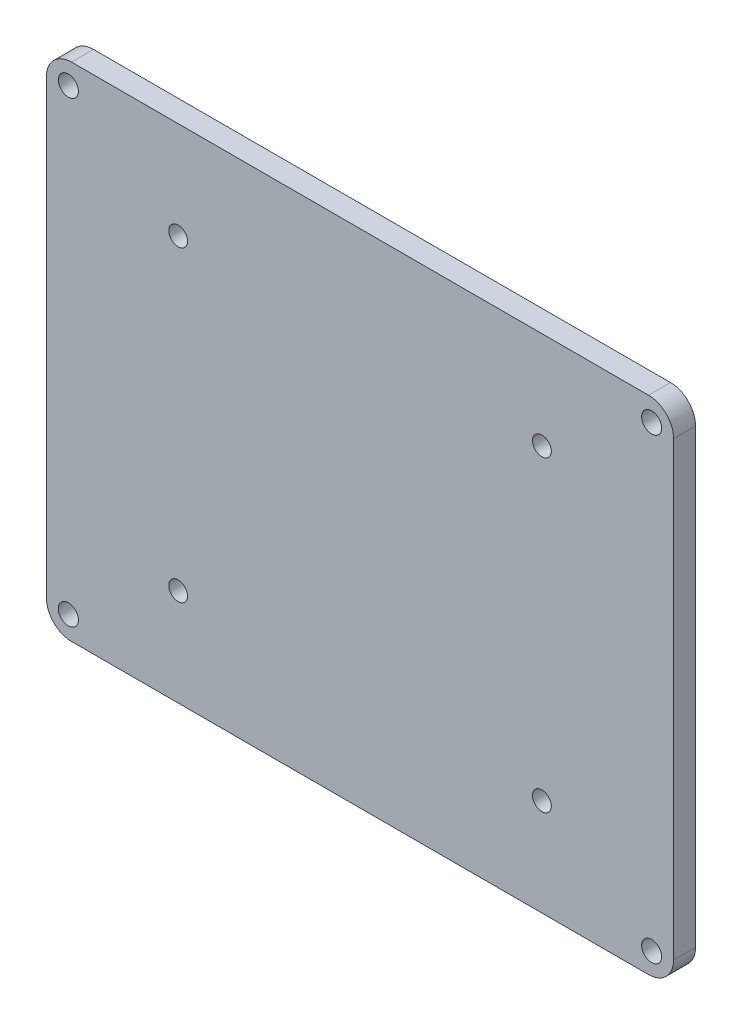
from build123d import *

# Parameters (mm, degrees)
SKETCH2_R           = 1.6
BOSS_EXTRUDE1_DEPTH = 3.5
SKETCH3_R           = 1.5
CUT_EXTRUDE1_DEPTH  = 8


with BuildPart() as part:
    # Sketch2 → Boss-Extrude1 (new body)
    with BuildSketch(Plane.XY):
        with BuildLine():
            Line((-46, -40), (46, -40))
            ThreePointArc((46, -40), (48.828427125, -38.828427125), (50, -36))
            Line((50, -36), (50, 36))
            ThreePointArc((50, 36), (48.828427125, 38.828427125), (46, 40))
            Line((46, 40), (-46, 40))
            ThreePointArc((-46, 40), (-48.828427125, 38.828427125), (-50, 36))
            Line((-50, 36), (-50, -36))
            ThreePointArc((-50, -36), (-48.828427125, -38.828427125), (-46, -40))
        make_face()
        with Locations((-46.5, 36.5)):
            Circle(SKETCH2_R, mode=Mode.SUBTRACT)
        with Locations((46.5, 36.5)):
            Circle(SKETCH2_R, mode=Mode.SUBTRACT)
        with Locations((-46.5, -36.5)):
            Circle(SKETCH2_R, mode=Mode.SUBTRACT)
        with Locations((46.5, -36.5)):
            Circle(SKETCH2_R, mode=Mode.SUBTRACT)
    extrude(amount=BOSS_EXTRUDE1_DEPTH)

    # Sketch3 → Cut-Extrude1 (cut)
    with BuildSketch(Plane.XY.offset(3.5)):
        with Locations((-29, 24.5)):
            Circle(SKETCH3_R)
        with Locations((-29, -24.5)):
            Circle(SKETCH3_R)
        with Locations((29, -24.5)):
            Circle(SKETCH3_R)
        with Locations((29, 24.5)):
            Circle(SKETCH3_R)
    extrude(amount=-CUT_EXTRUDE1_DEPTH, mode=Mode.SUBTRACT)


solid = part.part
